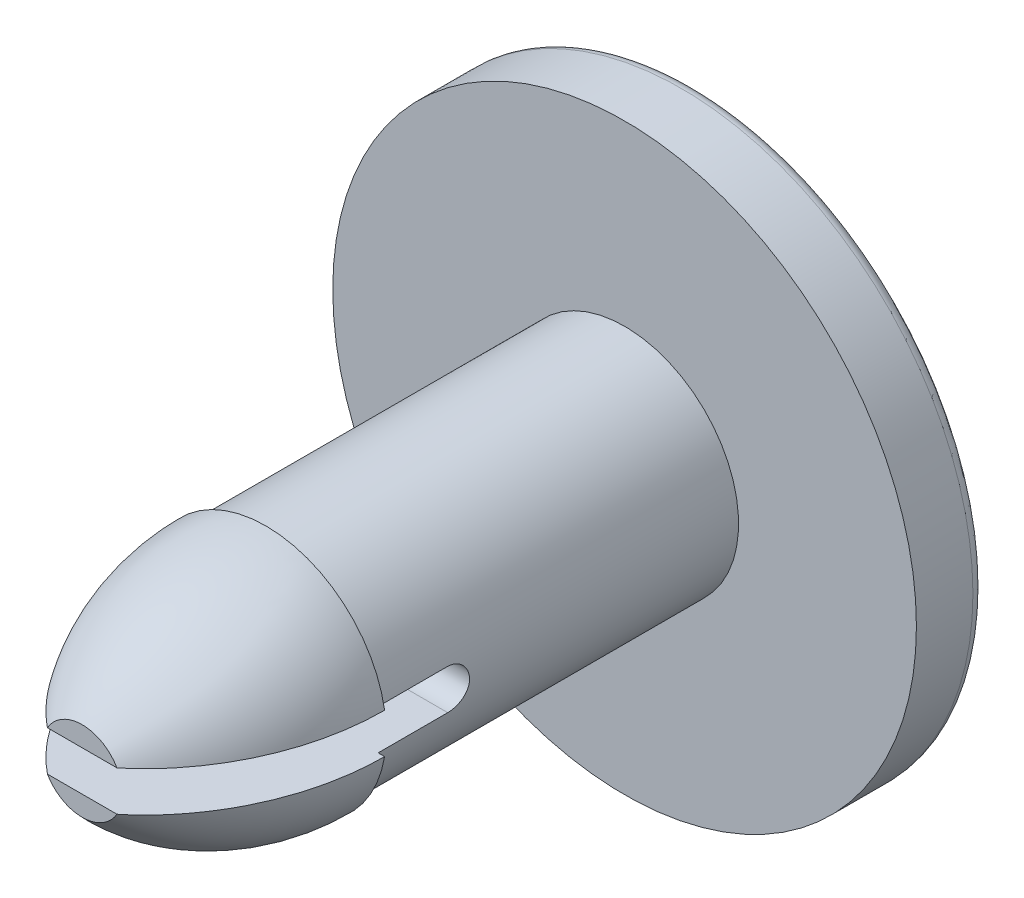
from build123d import *

# Parameters (mm, degrees)
SLOT_DEPTH      = 20.063575779
SLOT_DEPTH_BACK = 20.063575779
FILLET1_R       = 0.3175


with BuildPart() as part:
    # Sketch2 → Revolve1 (revolve)
    with BuildSketch(Plane(origin=(0, 0, 0), x_dir=(0, 0, -1), z_dir=(1, 0, 0)), mode=Mode.PRIVATE) as revolve1_sk:
        with BuildLine():
            Line((0, 0), (-15.7988, 0))
            Line((-15.7988, 0), (-15.7988, 1.037166667))
            ThreePointArc((-15.7988, 1.037166667), (-13.640498544, 2.570299796), (-11.049, 3.1115))
            Line((-11.049, 3.1115), (-11.049, 2.9464))
            Line((-11.049, 2.9464), (-1.778, 2.9464))
            Line((-1.778, 2.9464), (-1.778, 7.5438))
            Line((-1.778, 7.5438), (0, 7.5438))
            Line((0, 7.5438), (0, 0))
        make_face()
    revolve(revolve1_sk.sketch.rotate(Axis((0, 0, 0), (0, 0, 1)), 90), axis=Axis((0, 0, 0), (0, 0, 1)))

    # Sketch3 → Slot (cut, two sides: drawn at the far end of the back side and taken through both)
    with BuildSketch(Plane(origin=(0, 0, 0), x_dir=(0, 0, -1), z_dir=(1, 0, 0)).offset(-SLOT_DEPTH_BACK)):
        with BuildLine():
            Line((-9.249833333, 0.518583333), (-15.7988, 0.518583333))
            Line((-15.7988, 0.518583333), (-15.7988, -0.518583333))
            Line((-15.7988, -0.518583333), (-9.249833333, -0.518583333))
            ThreePointArc((-9.249833333, -0.518583333), (-8.73125, 0), (-9.249833333, 0.518583333))
        make_face()
    extrude(amount=SLOT_DEPTH + SLOT_DEPTH_BACK, mode=Mode.SUBTRACT)

    # Fillet1
    fillet1_edges = [part.edges().sort_by_distance(p)[0] for p in [
        (7.5438, 0, 0),
    ]]
    fillet(fillet1_edges, radius=FILLET1_R)


solid = part.part
